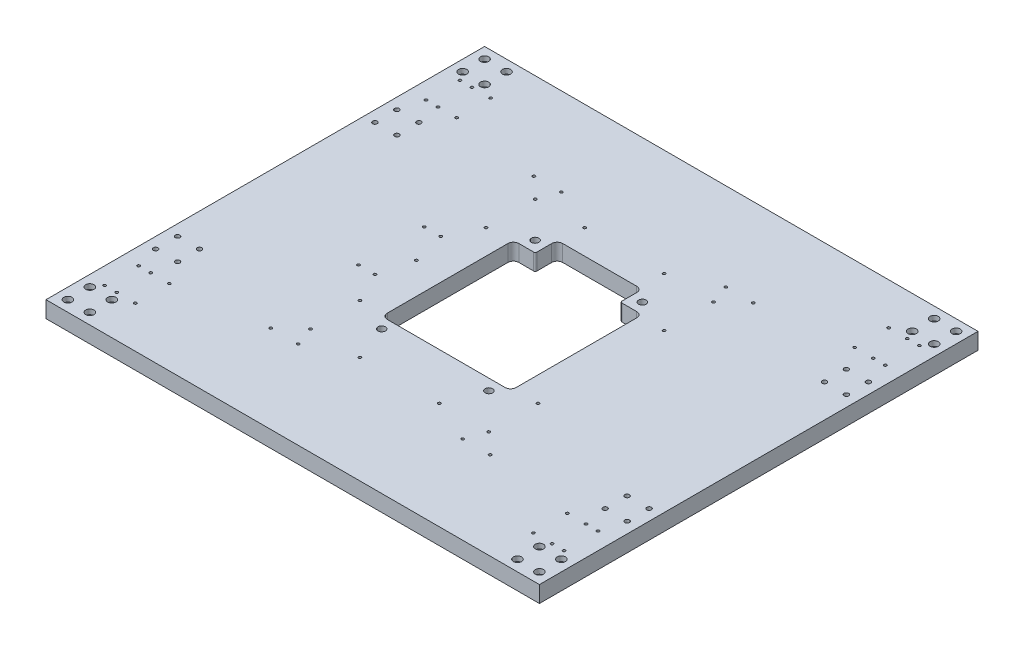
from build123d import *

# Parameters (mm, degrees)
SKETCH2_W                                            = 900
SKETCH2_H                                            = 800
BOSS_EXTRUDE1_DEPTH                                  = 30
M6_TAPPED_HOLE1_D                                    = 5
M6_TAPPED_HOLE1_DEPTH                                = 20
M6_TAPPED_HOLE1_TIP                                  = 1.502151548
SKETCH5_W                                            = 155
SKETCH5_H                                            = 280
CUT_EXTRUDE1_DEPTH                                   = 603.826674924
SKETCH9_W                                            = 235
SKETCH9_H                                            = 240
CUT_EXTRUDE2_DEPTH                                   = 603.826674924
FILLET2_R                                            = 3
CBORE_FOR_M12_HEXAGON_SOCKET_HEAD_CAP_SC_D           = 13.5
CBORE_FOR_M12_HEXAGON_SOCKET_HEAD_CAP_SC_CBORE_D     = 20
CBORE_FOR_M12_HEXAGON_SOCKET_HEAD_CAP_SC_CBORE_DEPTH = 13
FILLET1_R                                            = 10
M12_TAPPED_HOLE1_D                                   = 10.2
M12_TAPPED_HOLE1_DEPTH                               = 25
M12_TAPPED_HOLE1_TIP                                 = 3.064389157
CBORE_FOR_M8_HEXAGON_SOCKET_HEAD_CAP_SCR_D           = 8.4
CBORE_FOR_M8_HEXAGON_SOCKET_HEAD_CAP_SCR_CBORE_D     = 15
CBORE_FOR_M8_HEXAGON_SOCKET_HEAD_CAP_SCR_CBORE_DEPTH = 9
CBORE_FOR_M8_HEXAGON_SOCKET_HEAD_CAP_2_D             = 8.4
CBORE_FOR_M8_HEXAGON_SOCKET_HEAD_CAP_2_CBORE_D       = 15
CBORE_FOR_M8_HEXAGON_SOCKET_HEAD_CAP_2_CBORE_DEPTH   = 9


with BuildPart() as part:
    # Sketch2 → Boss-Extrude1 (new body)
    with BuildSketch(Plane(origin=(0, 0, 0), x_dir=(1, 0, 0), z_dir=(0, 1, 0))):
        Rectangle(SKETCH2_W, SKETCH2_H)
    extrude(amount=-BOSS_EXTRUDE1_DEPTH)

    # M6 Tapped Hole1
    with Locations(Plane(origin=(0, 0, 0), x_dir=(1, 0, 0), z_dir=(0, 1, 0))):
        with Locations((-419, 324.022), (-397, 324.022), (-363, 324.022), (-419, 262.022), (-397, 262.022), (-363, 262.022), (-200, 240), (-150, 240), (-162.5, 115), (-162.5, 205), (-72.5, 205), (-190.00186624, 60), (-220.00186624, 60), (-220.00186624, -60), (-190.00186624, -60), (-72.5, -205), (-162.5, -205), (-162.5, -115), (-150, -240), (-200, -240), (-363, -262.022), (-397, -262.022), (-419, -262.022), (-363, -324.022), (-397, -324.022), (-419, -324.022), (419, -324.022), (397, -324.022), (363, -324.022), (419, -262.022), (397, -262.022), (363, -262.022), (200, -240), (150, -240), (162.5, -115), (162.5, -205), (72.5, -205), (72.5, 205), (162.5, 205), (162.5, 115), (150, 240), (200, 240), (363, 262.022), (397, 262.022), (419, 262.022), (363, 324.022), (397, 324.022), (419, 324.022), (-174.35, 0)):
            Hole(M6_TAPPED_HOLE1_D / 2, depth=M6_TAPPED_HOLE1_DEPTH)
            with Locations((0, 0, -(M6_TAPPED_HOLE1_DEPTH + M6_TAPPED_HOLE1_TIP / 2))):  # 118° drill point
                Cone(0, M6_TAPPED_HOLE1_D / 2, M6_TAPPED_HOLE1_TIP, mode=Mode.SUBTRACT)

    # Sketch5 → Cut-Extrude1 (cut, through all)
    with BuildSketch(Plane.XZ.offset(30)):
        with Locations((0, -20)):
            Rectangle(SKETCH5_W, SKETCH5_H)
    extrude(amount=-CUT_EXTRUDE1_DEPTH, mode=Mode.SUBTRACT)

    # Sketch9 → Cut-Extrude2 (cut, through all)
    with BuildSketch(Plane(origin=(0, -30, 0), x_dir=(-1, 0, 0), z_dir=(0, -1, 0))):
        Rectangle(SKETCH9_W, SKETCH9_H)
    extrude(amount=-CUT_EXTRUDE2_DEPTH, mode=Mode.SUBTRACT)

    # Fillet2
    fillet2_edges = [part.edges().sort_by_distance(p)[0] for p in [
        (77.5, -15, -120),
        (-77.5, -15, -120),
    ]]
    fillet(fillet2_edges, radius=FILLET2_R)

    # CBORE for M12 Hexagon socket head cap screws1 (through all)
    with Locations(Plane(origin=(0, -30, 0), x_dir=(-1, 0, 0), z_dir=(0, -1, 0))):
        with Locations((-97.75, 140), (97.75, 140), (97.75, -140), (-97.75, -140)):
            CounterBoreHole(CBORE_FOR_M12_HEXAGON_SOCKET_HEAD_CAP_SC_D / 2, CBORE_FOR_M12_HEXAGON_SOCKET_HEAD_CAP_SC_CBORE_D / 2, CBORE_FOR_M12_HEXAGON_SOCKET_HEAD_CAP_SC_CBORE_DEPTH)

    # Fillet1
    fillet1_edges = [part.edges().sort_by_distance(p)[0] for p in [
        (-77.5, -15, -160),
        (77.5, -15, -160),
        (-117.5, -15, 120),
        (117.5, -15, -120),
        (-117.5, -15, -120),
        (117.5, -15, 120),
    ]]
    fillet(fillet1_edges, radius=FILLET1_R)

    # M12 Tapped Hole1
    with Locations(Plane(origin=(0, -30, 0), x_dir=(-1, 0, 0), z_dir=(0, -1, 0))):
        with Locations((-135, 20), (-135, -50), (135, -50), (135, 20), (-135, -15), (135, -15)):
            Hole(M12_TAPPED_HOLE1_D / 2, depth=M12_TAPPED_HOLE1_DEPTH)
            with Locations((0, 0, -(M12_TAPPED_HOLE1_DEPTH + M12_TAPPED_HOLE1_TIP / 2))):  # 118° drill point
                Cone(0, M12_TAPPED_HOLE1_D / 2, M12_TAPPED_HOLE1_TIP, mode=Mode.SUBTRACT)

    # CBORE for M8 Hexagon socket head cap scr (through all)
    with Locations(Plane(origin=(0, -30, 0), x_dir=(-1, 0, 0), z_dir=(0, -1, 0))):
        with Locations((-390, 180), (-430, 180), (-430, 220), (-390, 220), (-390, -220), (-430, -220), (-430, -180), (-390, -180), (390, -180), (430, -180), (430, -220), (390, -220), (390, 220), (430, 220), (430, 180), (390, 180)):
            CounterBoreHole(CBORE_FOR_M8_HEXAGON_SOCKET_HEAD_CAP_SCR_D / 2, CBORE_FOR_M8_HEXAGON_SOCKET_HEAD_CAP_SCR_CBORE_D / 2, CBORE_FOR_M8_HEXAGON_SOCKET_HEAD_CAP_SCR_CBORE_DEPTH)

    # CBORE for M8 Hexagon socket head cap 2 (through all)
    with Locations(Plane(origin=(0, 0, 0), x_dir=(1, 0, 0), z_dir=(0, 1, 0))):
        with Locations((390, 380), (430, 380), (430, 340), (390, 340), (390, -340), (430, -340), (430, -380), (390, -380), (-390, -380), (-430, -380), (-430, -340), (-390, -340), (-390, 340), (-430, 340), (-430, 380), (-390, 380)):
            CounterBoreHole(CBORE_FOR_M8_HEXAGON_SOCKET_HEAD_CAP_2_D / 2, CBORE_FOR_M8_HEXAGON_SOCKET_HEAD_CAP_2_CBORE_D / 2, CBORE_FOR_M8_HEXAGON_SOCKET_HEAD_CAP_2_CBORE_DEPTH)


solid = part.part
